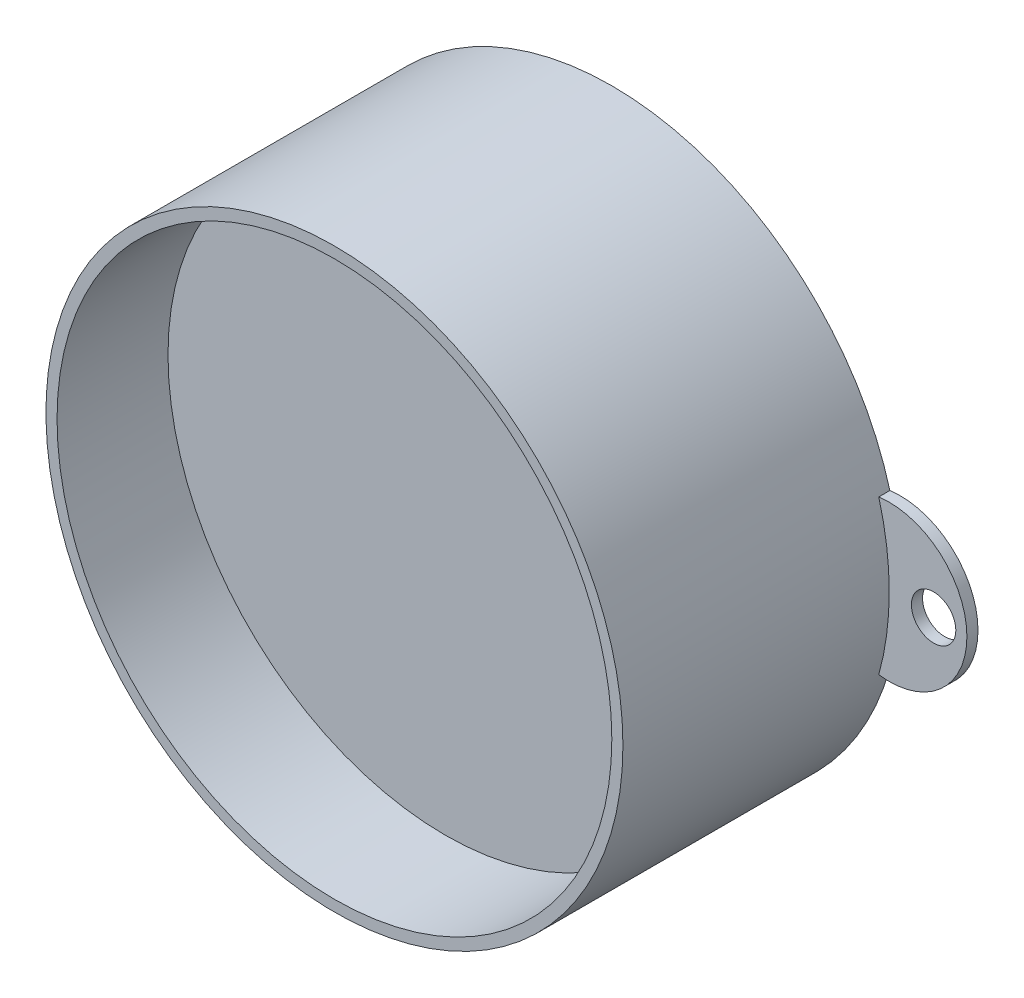
from build123d import *

# Parameters (mm, degrees)
ESQUISSE1_R             = 2
BOSS_EXTRU_1_DEPTH      = 1
BOSS_EXTRU_2_DEPTH      = 25
ESQUISSE2_R             = 25
ENL_V_MAT_EXTRU_1_DEPTH = 10


with BuildPart() as part:
    # Esquisse1 → Boss.-Extru.1 (new body)
    with BuildSketch(Plane.XY):
        with BuildLine():
            ThreePointArc((-25.057692308, -6.936285477), (0, -26), (25.057692308, -6.936285477))
            ThreePointArc((25.057692308, -6.936285477), (33, 0), (25.057692308, 6.936285477))
            ThreePointArc((25.057692308, 6.936285477), (0, 26), (-25.057692308, 6.936285477))
            ThreePointArc((-25.057692308, 6.936285477), (-33, 0), (-25.057692308, -6.936285477))
        make_face()
        with Locations((30, 0)):
            Circle(ESQUISSE1_R, mode=Mode.SUBTRACT)
        with Locations((-30, 0)):
            Circle(ESQUISSE1_R, mode=Mode.SUBTRACT)
    extrude(amount=BOSS_EXTRU_1_DEPTH)

    # Esquisse1<3> → Boss.-Extru.2 (add)
    with BuildSketch(Plane.XY):
        with BuildLine():
            ThreePointArc((25.057692308, -6.936285477), (25.763346056, -3.5), (26, 0))
            ThreePointArc((26, 0), (25.763346056, 3.5), (25.057692308, 6.936285477))
            ThreePointArc((25.057692308, 6.936285477), (0, 26), (-25.057692308, 6.936285477))
            ThreePointArc((-25.057692308, 6.936285477), (-26, 0), (-25.057692308, -6.936285477))
            ThreePointArc((-25.057692308, -6.936285477), (0, -26), (25.057692308, -6.936285477))
        make_face()
    extrude(amount=BOSS_EXTRU_2_DEPTH)

    # Esquisse2 → Enlèv. mat.-Extru.1 (cut)
    with BuildSketch(Plane.XY.offset(25)):
        Circle(ESQUISSE2_R)
    extrude(amount=-ENL_V_MAT_EXTRU_1_DEPTH, mode=Mode.SUBTRACT)


solid = part.part
